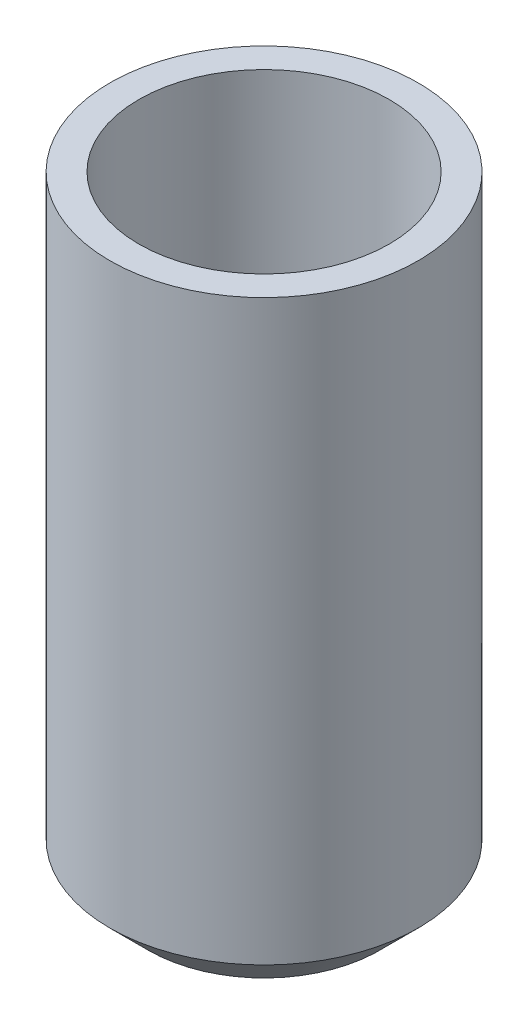
from build123d import *


with BuildPart() as part:
    # Sketch2 → Revolve1 (revolve)
    with BuildSketch(Plane(origin=(0, 0, 0), x_dir=(0, 0, -1), z_dir=(1, 0, 0)), mode=Mode.PRIVATE) as revolve1_sk:
        with BuildLine():
            Line((0, 0), (6, 0))
            Line((6, 0), (8, 2))
            Line((8, 2), (8, 32))
            Line((8, 32), (6.5, 32))
            Line((6.5, 32), (6.5, 12.060660172))
            Line((6.5, 12.060660172), (5.378679656, 6.5))
            Line((5.378679656, 6.5), (6.5, 6.5))
            Line((6.5, 6.5), (6.5, 2.621320344))
            Line((6.5, 2.621320344), (5.378679656, 1.5))
            Line((5.378679656, 1.5), (2.65014975, 1.5))
            ThreePointArc((2.65014975, 1.5), (1.35440333, 1.91896094), (0, 2.060660172))
            Line((0, 2.060660172), (0, 0))
        make_face()
    revolve(revolve1_sk.sketch.rotate(Axis((0, 2.060660172, 0), (0, -1, 0)), 180), axis=Axis((0, 2.060660172, 0), (0, -1, 0)))


solid = part.part
